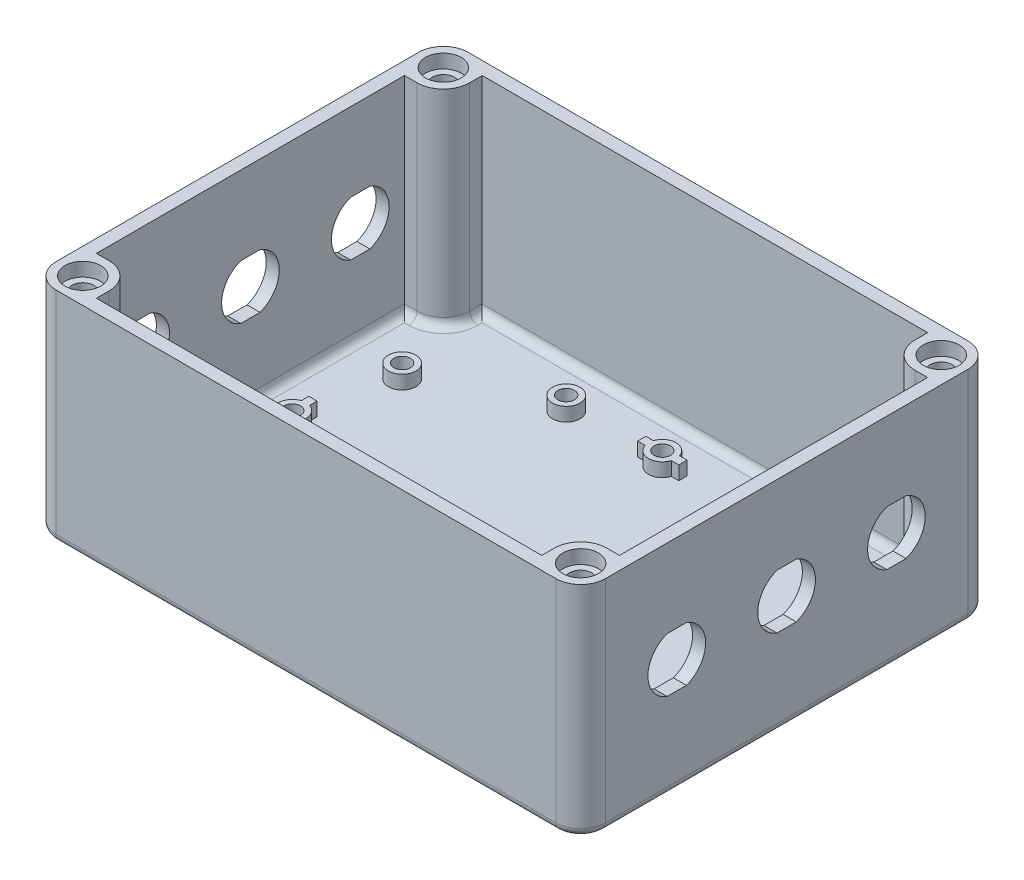
from build123d import *

# Parameters (mm, degrees)
SKETCH1_W           = 200
SKETCH1_H           = 150
BOSS_EXTRUDE1_DEPTH = 5
SKETCH2_W           = 200
SKETCH2_H           = 150
SKETCH2_W_2         = 190.5
SKETCH2_H_2         = 140.5
SKETCH2_R           = 4
BOSS_EXTRUDE2_DEPTH = 75
SKETCH3_R           = 6.5
CUT_EXTRUDE1_DEPTH  = 5
FILLET1_R           = 9
SKETCH4_R           = 5
SKETCH4_R_2         = 3
BOSS_EXTRUDE3_DEPTH = 5
FILLET2_R           = 3
FILLET3_R           = 3
CUT_EXTRUDE2_DEPTH  = 263.488094968


with BuildPart() as part:
    # Sketch1 → Boss-Extrude1 (new body)
    with BuildSketch(Plane(origin=(0, 0, 0), x_dir=(1, 0, 0), z_dir=(0, 1, 0))):
        with Locations((100, 75)):
            Rectangle(SKETCH1_W, SKETCH1_H)
    extrude(amount=BOSS_EXTRUDE1_DEPTH)

    # Sketch2 → Boss-Extrude2 (add)
    # profile 1 of 5: a face of its own
    with BuildSketch(Plane(origin=(0, 5, 0), x_dir=(1, 0, 0), z_dir=(0, 1, 0))):
        with Locations((100, 75)):
            Rectangle(SKETCH2_W, SKETCH2_H)
        with Locations((100, 75)):
            Rectangle(SKETCH2_W_2, SKETCH2_H_2, mode=Mode.SUBTRACT)
    # profile 2 of 5: a face of its own
    with BuildSketch(Plane(origin=(0, 5, 0), x_dir=(1, 0, 0), z_dir=(0, 1, 0))):
        with BuildLine():
            Line((4.75, 145.25), (4.75, 131.1))
            Line((4.75, 131.1), (9.346194078, 131.1))
            ThreePointArc((9.346194078, 131.1), (16.101755032, 133.898244968), (18.9, 140.653805922))
            Line((18.9, 140.653805922), (18.9, 145.25))
            Line((18.9, 145.25), (4.75, 145.25))
        make_face()
        with Locations(Location((9.346194078, 140.653805922, 0), (0, 0, 90))):
            Circle(SKETCH2_R, mode=Mode.SUBTRACT)
    # profile 3 of 5: a face of its own
    with BuildSketch(Plane(origin=(0, 5, 0), x_dir=(1, 0, 0), z_dir=(0, 1, 0))):
        with BuildLine():
            Line((190.653805922, 131.1), (195.25, 131.1))
            Line((195.25, 131.1), (195.25, 145.25))
            Line((195.25, 145.25), (181.1, 145.25))
            Line((181.1, 145.25), (181.1, 140.653805922))
            ThreePointArc((181.1, 140.653805922), (183.898244968, 133.898244968), (190.653805922, 131.1))
        make_face()
        with Locations(Location((190.653805922, 140.653805922, 0), (0, 0, 270))):
            Circle(SKETCH2_R, mode=Mode.SUBTRACT)
    # profile 4 of 5: a face of its own
    with BuildSketch(Plane(origin=(0, 5, 0), x_dir=(1, 0, 0), z_dir=(0, 1, 0))):
        with BuildLine():
            Line((181.1, 9.346194078), (181.1, 4.75))
            Line((181.1, 4.75), (195.25, 4.75))
            Line((195.25, 4.75), (195.25, 18.9))
            Line((195.25, 18.9), (190.653805922, 18.9))
            ThreePointArc((190.653805922, 18.9), (183.898244968, 16.101755032), (181.1, 9.346194078))
        make_face()
        with Locations(Location((190.653805922, 9.346194078, 0), (0, 0, 90))):
            Circle(SKETCH2_R, mode=Mode.SUBTRACT)
    # profile 5 of 5: a face of its own
    with BuildSketch(Plane(origin=(0, 5, 0), x_dir=(1, 0, 0), z_dir=(0, 1, 0))):
        with BuildLine():
            Line((4.75, 18.9), (4.75, 4.75))
            Line((4.75, 4.75), (18.9, 4.75))
            Line((18.9, 4.75), (18.9, 9.346194078))
            ThreePointArc((18.9, 9.346194078), (16.101755032, 16.101755032), (9.346194078, 18.9))
            Line((9.346194078, 18.9), (4.75, 18.9))
        make_face()
        with Locations(Location((9.346194078, 9.346194078, 0), (0, 0, 270))):
            Circle(SKETCH2_R, mode=Mode.SUBTRACT)
    extrude(amount=BOSS_EXTRUDE2_DEPTH)

    # Sketch3 → Cut-Extrude1 (cut)
    with BuildSketch(Plane(origin=(0, 80, 0), x_dir=(1, 0, 0), z_dir=(0, 1, 0))):
        with Locations(Location((9.346194078, 140.653805922, 0), (0, 0, 270))):
            Circle(SKETCH3_R)
        with Locations(Location((190.653805922, 140.653805922, 0), (0, 0, 270))):
            Circle(SKETCH3_R)
        with Locations(Location((190.653805922, 9.346194078, 0), (0, 0, 270))):
            Circle(SKETCH3_R)
        with Locations(Location((9.346194078, 9.346194078, 0), (0, 0, 270))):
            Circle(SKETCH3_R)
    extrude(amount=-CUT_EXTRUDE1_DEPTH, mode=Mode.SUBTRACT)

    # Fillet1
    fillet1_edges = [part.edges().sort_by_distance(p)[0] for p in [
        (0, 40, -150),
        (200, 40, -150),
        (200, 40, 0),
        (0, 40, 0),
    ]]
    fillet(fillet1_edges, radius=FILLET1_R)

    # Sketch4 → Boss-Extrude3 (add)
    # profile 1 of 40: a face of its own
    with BuildSketch(Plane(origin=(0, 5, 0), x_dir=(1, 0, 0), z_dir=(0, 1, 0))):
        with Locations(Location((65, 129.75, 0), (0, 0, 90))):
            Circle(SKETCH4_R)
        with Locations(Location((65, 129.75, 0), (0, 0, 270))):
            Circle(SKETCH4_R_2, mode=Mode.SUBTRACT)
    # profile 2 of 40: a face of its own
    with BuildSketch(Plane(origin=(0, 5, 0), x_dir=(1, 0, 0), z_dir=(0, 1, 0))):
        with Locations(Location((25, 110, 0), (0, 0, 90))):
            Circle(SKETCH4_R)
        with Locations(Location((25, 110, 0), (0, 0, 270))):
            Circle(SKETCH4_R_2, mode=Mode.SUBTRACT)
    # profile 3 of 40: a face of its own
    with BuildSketch(Plane(origin=(0, 5, 0), x_dir=(1, 0, 0), z_dir=(0, 1, 0))):
        with BuildLine():
            Line((21.5, 82.5), (18.5, 82.5))
            Line((18.5, 82.5), (18.5, 79.769696007))
            ThreePointArc((18.5, 79.769696007), (20, 80), (21.5, 79.769696007))
            Line((21.5, 79.769696007), (21.5, 82.5))
        make_face()
    # profile 4 of 40: a face of its own
    with BuildSketch(Plane(origin=(0, 5, 0), x_dir=(1, 0, 0), z_dir=(0, 1, 0))):
        with BuildLine():
            ThreePointArc((21.5, 79.769696007), (20, 80), (18.5, 79.769696007))
            Line((18.5, 79.769696007), (18.5, 77.598076211))
            ThreePointArc((18.5, 77.598076211), (20, 78), (21.5, 77.598076211))
            Line((21.5, 77.598076211), (21.5, 79.769696007))
        make_face()
    # profile 5 of 40: a face of its own
    with BuildSketch(Plane(origin=(0, 5, 0), x_dir=(1, 0, 0), z_dir=(0, 1, 0))):
        with BuildLine():
            Line((18.5, 72.401923789), (18.5, 70.230303993))
            ThreePointArc((18.5, 70.230303993), (20, 70), (21.5, 70.230303993))
            Line((21.5, 70.230303993), (21.5, 72.401923789))
            ThreePointArc((21.5, 72.401923789), (20, 72), (18.5, 72.401923789))
        make_face()
    # profile 6 of 40: a face of its own
    with BuildSketch(Plane(origin=(0, 5, 0), x_dir=(1, 0, 0), z_dir=(0, 1, 0))):
        with BuildLine():
            Line((18.5, 77.598076211), (18.5, 79.769696007))
            ThreePointArc((18.5, 79.769696007), (15, 75), (18.5, 70.230303993))
            Line((18.5, 70.230303993), (18.5, 72.401923789))
            ThreePointArc((18.5, 72.401923789), (17, 75), (18.5, 77.598076211))
        make_face()
    # profile 7 of 40: a face of its own
    with BuildSketch(Plane(origin=(0, 5, 0), x_dir=(1, 0, 0), z_dir=(0, 1, 0))):
        with BuildLine():
            ThreePointArc((25, 75), (24.031128874, 77.958039892), (21.5, 79.769696007))
            Line((21.5, 79.769696007), (21.5, 77.598076211))
            ThreePointArc((21.5, 77.598076211), (22.598076211, 76.5), (23, 75))
            ThreePointArc((23, 75), (22.598076211, 73.5), (21.5, 72.401923789))
            Line((21.5, 72.401923789), (21.5, 70.230303993))
            ThreePointArc((21.5, 70.230303993), (24.031128874, 72.041960108), (25, 75))
        make_face()
    # profile 8 of 40: a face of its own
    with BuildSketch(Plane(origin=(0, 5, 0), x_dir=(1, 0, 0), z_dir=(0, 1, 0))):
        with BuildLine():
            ThreePointArc((21.5, 79.769696007), (20, 80), (18.5, 79.769696007))
            Line((18.5, 79.769696007), (18.5, 77.598076211))
            ThreePointArc((18.5, 77.598076211), (20, 78), (21.5, 77.598076211))
            Line((21.5, 77.598076211), (21.5, 79.769696007))
        make_face()
    # profile 9 of 40: a face of its own
    with BuildSketch(Plane(origin=(0, 5, 0), x_dir=(1, 0, 0), z_dir=(0, 1, 0))):
        with BuildLine():
            Line((18.5, 72.401923789), (18.5, 70.230303993))
            ThreePointArc((18.5, 70.230303993), (20, 70), (21.5, 70.230303993))
            Line((21.5, 70.230303993), (21.5, 72.401923789))
            ThreePointArc((21.5, 72.401923789), (20, 72), (18.5, 72.401923789))
        make_face()
    # profile 10 of 40: a face of its own
    with BuildSketch(Plane(origin=(0, 5, 0), x_dir=(1, 0, 0), z_dir=(0, 1, 0))):
        with BuildLine():
            ThreePointArc((21.5, 70.230303993), (20, 70), (18.5, 70.230303993))
            Line((18.5, 70.230303993), (18.5, 67.5))
            Line((18.5, 67.5), (21.5, 67.5))
            Line((21.5, 67.5), (21.5, 70.230303993))
        make_face()
    # profile 11 of 40: a face of its own
    with BuildSketch(Plane(origin=(0, 5, 0), x_dir=(1, 0, 0), z_dir=(0, 1, 0))):
        with Locations(Location((25, 40, 0), (0, 0, 90))):
            Circle(SKETCH4_R)
        with Locations(Location((25, 40, 0), (0, 0, 270))):
            Circle(SKETCH4_R_2, mode=Mode.SUBTRACT)
    # profile 12 of 40: a face of its own
    with BuildSketch(Plane(origin=(0, 5, 0), x_dir=(1, 0, 0), z_dir=(0, 1, 0))):
        with Locations(Location((65, 20.25, 0), (0, 0, 90))):
            Circle(SKETCH4_R)
        with Locations(Location((65, 20.25, 0), (0, 0, 270))):
            Circle(SKETCH4_R_2, mode=Mode.SUBTRACT)
    # profile 13 of 40: a face of its own
    with BuildSketch(Plane(origin=(0, 5, 0), x_dir=(1, 0, 0), z_dir=(0, 1, 0))):
        with BuildLine():
            ThreePointArc((104.769696007, 21.75), (100, 25.25), (95.230303993, 21.75))
            Line((95.230303993, 21.75), (97.401923789, 21.75))
            ThreePointArc((97.401923789, 21.75), (100, 23.25), (102.598076211, 21.75))
            Line((102.598076211, 21.75), (104.769696007, 21.75))
        make_face()
    # profile 14 of 40: a face of its own
    with BuildSketch(Plane(origin=(0, 5, 0), x_dir=(1, 0, 0), z_dir=(0, 1, 0))):
        with BuildLine():
            Line((97.401923789, 21.75), (95.230303993, 21.75))
            ThreePointArc((95.230303993, 21.75), (95, 20.25), (95.230303993, 18.75))
            Line((95.230303993, 18.75), (97.401923789, 18.75))
            ThreePointArc((97.401923789, 18.75), (97, 20.25), (97.401923789, 21.75))
        make_face()
    # profile 15 of 40: a face of its own
    with BuildSketch(Plane(origin=(0, 5, 0), x_dir=(1, 0, 0), z_dir=(0, 1, 0))):
        with BuildLine():
            ThreePointArc((105, 20.25), (104.942088629, 21.008788496), (104.769696007, 21.75))
            Line((104.769696007, 21.75), (102.598076211, 21.75))
            ThreePointArc((102.598076211, 21.75), (102.897777479, 21.026457135), (103, 20.25))
            ThreePointArc((103, 20.25), (102.897777479, 19.473542865), (102.598076211, 18.75))
            Line((102.598076211, 18.75), (104.769696007, 18.75))
            ThreePointArc((104.769696007, 18.75), (104.942088629, 19.491211504), (105, 20.25))
        make_face()
    # profile 16 of 40: a face of its own
    with BuildSketch(Plane(origin=(0, 5, 0), x_dir=(1, 0, 0), z_dir=(0, 1, 0))):
        with BuildLine():
            Line((95.230303993, 21.75), (92.5, 21.75))
            Line((92.5, 21.75), (92.5, 18.75))
            Line((92.5, 18.75), (95.230303993, 18.75))
            ThreePointArc((95.230303993, 18.75), (95, 20.25), (95.230303993, 21.75))
        make_face()
    # profile 17 of 40: a face of its own
    with BuildSketch(Plane(origin=(0, 5, 0), x_dir=(1, 0, 0), z_dir=(0, 1, 0))):
        with BuildLine():
            Line((97.401923789, 18.75), (95.230303993, 18.75))
            ThreePointArc((95.230303993, 18.75), (100, 15.25), (104.769696007, 18.75))
            Line((104.769696007, 18.75), (102.598076211, 18.75))
            ThreePointArc((102.598076211, 18.75), (100, 17.25), (97.401923789, 18.75))
        make_face()
    # profile 18 of 40: a face of its own
    with BuildSketch(Plane(origin=(0, 5, 0), x_dir=(1, 0, 0), z_dir=(0, 1, 0))):
        with BuildLine():
            Line((107.5, 21.75), (104.769696007, 21.75))
            ThreePointArc((104.769696007, 21.75), (104.942088629, 21.008788496), (105, 20.25))
            ThreePointArc((105, 20.25), (104.942088629, 19.491211504), (104.769696007, 18.75))
            Line((104.769696007, 18.75), (107.5, 18.75))
            Line((107.5, 18.75), (107.5, 21.75))
        make_face()
    # profile 19 of 40: a face of its own
    with BuildSketch(Plane(origin=(0, 5, 0), x_dir=(1, 0, 0), z_dir=(0, 1, 0))):
        with BuildLine():
            Line((97.401923789, 21.75), (95.230303993, 21.75))
            ThreePointArc((95.230303993, 21.75), (95, 20.25), (95.230303993, 18.75))
            Line((95.230303993, 18.75), (97.401923789, 18.75))
            ThreePointArc((97.401923789, 18.75), (97, 20.25), (97.401923789, 21.75))
        make_face()
    # profile 20 of 40: a face of its own
    with BuildSketch(Plane(origin=(0, 5, 0), x_dir=(1, 0, 0), z_dir=(0, 1, 0))):
        with BuildLine():
            ThreePointArc((105, 20.25), (104.942088629, 21.008788496), (104.769696007, 21.75))
            Line((104.769696007, 21.75), (102.598076211, 21.75))
            ThreePointArc((102.598076211, 21.75), (102.897777479, 21.026457135), (103, 20.25))
            ThreePointArc((103, 20.25), (102.897777479, 19.473542865), (102.598076211, 18.75))
            Line((102.598076211, 18.75), (104.769696007, 18.75))
            ThreePointArc((104.769696007, 18.75), (104.942088629, 19.491211504), (105, 20.25))
        make_face()
    # profile 21 of 40: a face of its own
    with BuildSketch(Plane(origin=(0, 5, 0), x_dir=(1, 0, 0), z_dir=(0, 1, 0))):
        with Locations(Location((135, 20.25, 0), (0, 0, 270))):
            Circle(SKETCH4_R)
        with Locations(Location((135, 20.25, 0), (0, 0, 90))):
            Circle(SKETCH4_R_2, mode=Mode.SUBTRACT)
    # profile 22 of 40: a face of its own
    with BuildSketch(Plane(origin=(0, 5, 0), x_dir=(1, 0, 0), z_dir=(0, 1, 0))):
        with Locations(Location((175, 40, 0), (0, 0, 270))):
            Circle(SKETCH4_R)
        with Locations(Location((175, 40, 0), (0, 0, 90))):
            Circle(SKETCH4_R_2, mode=Mode.SUBTRACT)
    # profile 23 of 40: a face of its own
    with BuildSketch(Plane(origin=(0, 5, 0), x_dir=(1, 0, 0), z_dir=(0, 1, 0))):
        with BuildLine():
            Line((178.5, 82.5), (178.5, 79.769696007))
            ThreePointArc((178.5, 79.769696007), (180, 80), (181.5, 79.769696007))
            Line((181.5, 79.769696007), (181.5, 82.5))
            Line((181.5, 82.5), (178.5, 82.5))
        make_face()
    # profile 24 of 40: a face of its own
    with BuildSketch(Plane(origin=(0, 5, 0), x_dir=(1, 0, 0), z_dir=(0, 1, 0))):
        with BuildLine():
            ThreePointArc((178.5, 79.769696007), (175, 75), (178.5, 70.230303993))
            Line((178.5, 70.230303993), (178.5, 72.401923789))
            ThreePointArc((178.5, 72.401923789), (177, 75), (178.5, 77.598076211))
            Line((178.5, 77.598076211), (178.5, 79.769696007))
        make_face()
    # profile 25 of 40: a face of its own
    with BuildSketch(Plane(origin=(0, 5, 0), x_dir=(1, 0, 0), z_dir=(0, 1, 0))):
        with BuildLine():
            ThreePointArc((178.5, 70.230303993), (180, 70), (181.5, 70.230303993))
            Line((181.5, 70.230303993), (181.5, 72.401923789))
            ThreePointArc((181.5, 72.401923789), (180, 72), (178.5, 72.401923789))
            Line((178.5, 72.401923789), (178.5, 70.230303993))
        make_face()
    # profile 26 of 40: a face of its own
    with BuildSketch(Plane(origin=(0, 5, 0), x_dir=(1, 0, 0), z_dir=(0, 1, 0))):
        with BuildLine():
            ThreePointArc((181.5, 79.769696007), (180, 80), (178.5, 79.769696007))
            Line((178.5, 79.769696007), (178.5, 77.598076211))
            ThreePointArc((178.5, 77.598076211), (180, 78), (181.5, 77.598076211))
            Line((181.5, 77.598076211), (181.5, 79.769696007))
        make_face()
    # profile 27 of 40: a face of its own
    with BuildSketch(Plane(origin=(0, 5, 0), x_dir=(1, 0, 0), z_dir=(0, 1, 0))):
        with BuildLine():
            Line((181.5, 72.401923789), (181.5, 70.230303993))
            ThreePointArc((181.5, 70.230303993), (184.031128874, 72.041960108), (185, 75))
            ThreePointArc((185, 75), (184.031128874, 77.958039892), (181.5, 79.769696007))
            Line((181.5, 79.769696007), (181.5, 77.598076211))
            ThreePointArc((181.5, 77.598076211), (182.598076211, 76.5), (183, 75))
            ThreePointArc((183, 75), (182.598076211, 73.5), (181.5, 72.401923789))
        make_face()
    # profile 28 of 40: a face of its own
    with BuildSketch(Plane(origin=(0, 5, 0), x_dir=(1, 0, 0), z_dir=(0, 1, 0))):
        with BuildLine():
            ThreePointArc((178.5, 70.230303993), (180, 70), (181.5, 70.230303993))
            Line((181.5, 70.230303993), (181.5, 72.401923789))
            ThreePointArc((181.5, 72.401923789), (180, 72), (178.5, 72.401923789))
            Line((178.5, 72.401923789), (178.5, 70.230303993))
        make_face()
    # profile 29 of 40: a face of its own
    with BuildSketch(Plane(origin=(0, 5, 0), x_dir=(1, 0, 0), z_dir=(0, 1, 0))):
        with BuildLine():
            ThreePointArc((181.5, 79.769696007), (180, 80), (178.5, 79.769696007))
            Line((178.5, 79.769696007), (178.5, 77.598076211))
            ThreePointArc((178.5, 77.598076211), (180, 78), (181.5, 77.598076211))
            Line((181.5, 77.598076211), (181.5, 79.769696007))
        make_face()
    # profile 30 of 40: a face of its own
    with BuildSketch(Plane(origin=(0, 5, 0), x_dir=(1, 0, 0), z_dir=(0, 1, 0))):
        with BuildLine():
            Line((178.5, 67.5), (181.5, 67.5))
            Line((181.5, 67.5), (181.5, 70.230303993))
            ThreePointArc((181.5, 70.230303993), (180, 70), (178.5, 70.230303993))
            Line((178.5, 70.230303993), (178.5, 67.5))
        make_face()
    # profile 31 of 40: a face of its own
    with BuildSketch(Plane(origin=(0, 5, 0), x_dir=(1, 0, 0), z_dir=(0, 1, 0))):
        with Locations(Location((175, 110, 0), (0, 0, 270))):
            Circle(SKETCH4_R)
        with Locations(Location((175, 110, 0), (0, 0, 90))):
            Circle(SKETCH4_R_2, mode=Mode.SUBTRACT)
    # profile 32 of 40: a face of its own
    with BuildSketch(Plane(origin=(0, 5, 0), x_dir=(1, 0, 0), z_dir=(0, 1, 0))):
        with Locations(Location((135, 129.75, 0), (0, 0, 270))):
            Circle(SKETCH4_R)
        with Locations(Location((135, 129.75, 0), (0, 0, 90))):
            Circle(SKETCH4_R_2, mode=Mode.SUBTRACT)
    # profile 33 of 40: a face of its own
    with BuildSketch(Plane(origin=(0, 5, 0), x_dir=(1, 0, 0), z_dir=(0, 1, 0))):
        with BuildLine():
            ThreePointArc((104.769696007, 131.25), (100, 134.75), (95.230303993, 131.25))
            Line((95.230303993, 131.25), (97.401923789, 131.25))
            ThreePointArc((97.401923789, 131.25), (100, 132.75), (102.598076211, 131.25))
            Line((102.598076211, 131.25), (104.769696007, 131.25))
        make_face()
    # profile 34 of 40: a face of its own
    with BuildSketch(Plane(origin=(0, 5, 0), x_dir=(1, 0, 0), z_dir=(0, 1, 0))):
        with BuildLine():
            Line((107.5, 131.25), (104.769696007, 131.25))
            ThreePointArc((104.769696007, 131.25), (104.942088629, 130.508788496), (105, 129.75))
            ThreePointArc((105, 129.75), (104.942088629, 128.991211504), (104.769696007, 128.25))
            Line((104.769696007, 128.25), (107.5, 128.25))
            Line((107.5, 128.25), (107.5, 131.25))
        make_face()
    # profile 35 of 40: a face of its own
    with BuildSketch(Plane(origin=(0, 5, 0), x_dir=(1, 0, 0), z_dir=(0, 1, 0))):
        with BuildLine():
            Line((97.401923789, 131.25), (95.230303993, 131.25))
            ThreePointArc((95.230303993, 131.25), (95, 129.75), (95.230303993, 128.25))
            Line((95.230303993, 128.25), (97.401923789, 128.25))
            ThreePointArc((97.401923789, 128.25), (97, 129.75), (97.401923789, 131.25))
        make_face()
    # profile 36 of 40: a face of its own
    with BuildSketch(Plane(origin=(0, 5, 0), x_dir=(1, 0, 0), z_dir=(0, 1, 0))):
        with BuildLine():
            ThreePointArc((105, 129.75), (104.942088629, 130.508788496), (104.769696007, 131.25))
            Line((104.769696007, 131.25), (102.598076211, 131.25))
            ThreePointArc((102.598076211, 131.25), (102.897777479, 130.526457135), (103, 129.75))
            ThreePointArc((103, 129.75), (102.897777479, 128.973542865), (102.598076211, 128.25))
            Line((102.598076211, 128.25), (104.769696007, 128.25))
            ThreePointArc((104.769696007, 128.25), (104.942088629, 128.991211504), (105, 129.75))
        make_face()
    # profile 37 of 40: a face of its own
    with BuildSketch(Plane(origin=(0, 5, 0), x_dir=(1, 0, 0), z_dir=(0, 1, 0))):
        with BuildLine():
            Line((97.401923789, 131.25), (95.230303993, 131.25))
            ThreePointArc((95.230303993, 131.25), (95, 129.75), (95.230303993, 128.25))
            Line((95.230303993, 128.25), (97.401923789, 128.25))
            ThreePointArc((97.401923789, 128.25), (97, 129.75), (97.401923789, 131.25))
        make_face()
    # profile 38 of 40: a face of its own
    with BuildSketch(Plane(origin=(0, 5, 0), x_dir=(1, 0, 0), z_dir=(0, 1, 0))):
        with BuildLine():
            ThreePointArc((105, 129.75), (104.942088629, 130.508788496), (104.769696007, 131.25))
            Line((104.769696007, 131.25), (102.598076211, 131.25))
            ThreePointArc((102.598076211, 131.25), (102.897777479, 130.526457135), (103, 129.75))
            ThreePointArc((103, 129.75), (102.897777479, 128.973542865), (102.598076211, 128.25))
            Line((102.598076211, 128.25), (104.769696007, 128.25))
            ThreePointArc((104.769696007, 128.25), (104.942088629, 128.991211504), (105, 129.75))
        make_face()
    # profile 39 of 40: a face of its own
    with BuildSketch(Plane(origin=(0, 5, 0), x_dir=(1, 0, 0), z_dir=(0, 1, 0))):
        with BuildLine():
            Line((95.230303993, 131.25), (92.5, 131.25))
            Line((92.5, 131.25), (92.5, 128.25))
            Line((92.5, 128.25), (95.230303993, 128.25))
            ThreePointArc((95.230303993, 128.25), (95, 129.75), (95.230303993, 131.25))
        make_face()
    # profile 40 of 40: a face of its own
    with BuildSketch(Plane(origin=(0, 5, 0), x_dir=(1, 0, 0), z_dir=(0, 1, 0))):
        with BuildLine():
            Line((97.401923789, 128.25), (95.230303993, 128.25))
            ThreePointArc((95.230303993, 128.25), (100, 124.75), (104.769696007, 128.25))
            Line((104.769696007, 128.25), (102.598076211, 128.25))
            ThreePointArc((102.598076211, 128.25), (100, 126.75), (97.401923789, 128.25))
        make_face()
    extrude(amount=BOSS_EXTRUDE3_DEPTH)

    # Fillet2
    fillet2_edges = [part.edges().sort_by_distance(p)[0] for p in [
        (192.951902961, 5, -18.9),
        (18.9, 5, -7.048097039),
        (16.101755032, 5, -16.101755032),
        (4.75, 5, -75),
        (7.048097039, 5, -131.1),
        (100, 5, -145.25),
        (181.1, 5, -142.951902961),
        (183.898244968, 5, -133.898244968),
        (195.25, 5, -75),
        (192.951902961, 5, -131.1),
        (18.9, 5, -142.951902961),
        (16.101755032, 5, -133.898244968),
        (7.048097039, 5, -18.9),
        (100, 5, -4.75),
        (181.1, 5, -7.048097039),
        (183.898244968, 5, -16.101755032),
    ]]
    fillet(fillet2_edges, radius=FILLET2_R)

    # Fillet3
    fillet3_edges = [part.edges().sort_by_distance(p)[0] for p in [
        (100, 0, -150),
        (0, 0, -75),
        (200, 0, -75),
        (100, 0, 0),
        (2.636038969, 0, -147.363961031),
        (2.636038969, 0, -2.636038969),
        (197.363961031, 0, -2.636038969),
        (197.363961031, 0, -147.363961031),
    ]]
    fillet(fillet3_edges, radius=FILLET3_R)

    # Sketch5 → Cut-Extrude2 (cut, through all)
    with BuildSketch(Plane.ZY):
        with BuildLine():
            Line((-118.498571137, 51.4), (-111.501428863, 51.4))
            ThreePointArc((-111.501428863, 51.4), (-104.5, 41.5), (-111.501428863, 31.6))
            Line((-111.501428863, 31.6), (-118.498571137, 31.6))
            ThreePointArc((-118.498571137, 31.6), (-125.5, 41.5), (-118.498571137, 51.4))
        make_face()
        with BuildLine():
            Line((-78.498571137, 51.4), (-71.501428863, 51.4))
            ThreePointArc((-71.501428863, 51.4), (-64.5, 41.5), (-71.501428863, 31.6))
            Line((-71.501428863, 31.6), (-78.498571137, 31.6))
            ThreePointArc((-78.498571137, 31.6), (-85.5, 41.5), (-78.498571137, 51.4))
        make_face()
        with BuildLine():
            Line((-31.501428863, 31.6), (-38.498571137, 31.6))
            ThreePointArc((-38.498571137, 31.6), (-45.5, 41.5), (-38.498571137, 51.4))
            Line((-38.498571137, 51.4), (-31.501428863, 51.4))
            ThreePointArc((-31.501428863, 51.4), (-24.5, 41.5), (-31.501428863, 31.6))
        make_face()
    extrude(amount=-CUT_EXTRUDE2_DEPTH, mode=Mode.SUBTRACT)


solid = part.part
